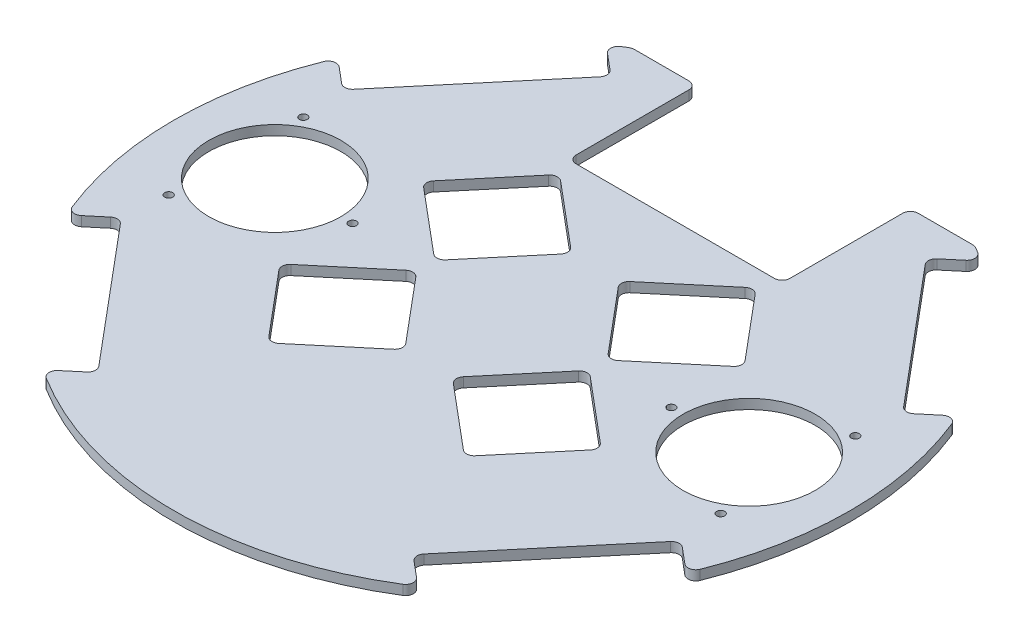
from build123d import *

# Parameters (mm, degrees)
ESBO_O1_R                = 87
RESSALTO_EXTRUS_O1_DEPTH = 2.5
CORTE_EXTRUS_O1_DEPTH    = 2.5
CORTE_EXTRUS_O2_START    = -2.5
ESBO_O3_W                = 27.5
ESBO_O3_H                = 33
CORTE_EXTRUS_O2_DEPTH    = 2.5
FILETE2_R                = 2
ESBO_O4_R                = 17
CORTE_EXTRUS_O3_DEPTH    = 4
CORTE_EXTRUS_O5_DEPTH    = 3
FURO_ROSCADO_DE_M2_51_D  = 2.05


with BuildPart() as part:
    # Esboço1 → Ressalto-extrusão1 (new body)
    with BuildSketch(Plane(origin=(0, 0, 0), x_dir=(1, 0, 0), z_dir=(0, 1, 0))):
        with Locations(Location((0, 0, 0), (0, 0, 270))):
            Circle(ESBO_O1_R)
    extrude(amount=RESSALTO_EXTRUS_O1_DEPTH)

    # Esboço2 → Corte-extrusão1 (cut)
    with BuildSketch(Plane(origin=(0, 2.5, 0), x_dir=(1, 0, 0), z_dir=(0, 1, 0))):
        Polygon((66.645866551, 55.922522043), (82.394162989, 37.154433186), (79.696950599, 34.891203265), (72.036506168, 28.463327168), (40.539913293, 65.999504881), (48.200357724, 72.427380978), (50.897570114, 74.690610899), align=None)
        Polygon((50.897570114, -74.690610899), (82.394162989, -37.154433186), (79.696950599, -34.891203265), (72.036506168, -28.463327168), (40.539913293, -65.999504881), (48.200357724, -72.427380978), align=None)
        Polygon((-72.036506168, 28.463327168), (-40.539913293, 65.999504881), (-48.200357724, 72.427380978), (-50.897570114, 74.690610899), (-66.645866551, 55.922522043), (-82.394162989, 37.154433186), (-79.696950599, 34.891203265), align=None)
        Polygon((-79.696950599, -34.891203265), (-82.394162989, -37.154433186), (-50.897570114, -74.690610899), (-48.200357724, -72.427380978), (-40.539913293, -65.999504881), (-72.036506168, -28.463327168), align=None)
    extrude(amount=-CORTE_EXTRUS_O1_DEPTH, mode=Mode.SUBTRACT)

    # Esboço3 → Corte-extrusão2 (cut)
    with BuildSketch(Plane(origin=(0, 2.5, 0), x_dir=(1, 0, 0), z_dir=(0, 1, 0)).offset(CORTE_EXTRUS_O2_START)):
        with Locations((-13.75, 58.5)):
            Rectangle(ESBO_O3_W, ESBO_O3_H)
        with Locations((13.75, 58.5)):
            Rectangle(ESBO_O3_W, ESBO_O3_H)
        with BuildLine():
            Line((0, 87), (0, 75))
            Line((0, 75), (27.5, 75))
            Line((27.5, 75), (44.09081537, 75))
            ThreePointArc((44.09081537, 75), (22.847319318, 83.946411478), (0, 87))
        make_face()
        with BuildLine():
            Line((-27.5, 75), (0, 75))
            Line((0, 75), (0, 87))
            ThreePointArc((0, 87), (-22.847319318, 83.946411478), (-44.09081537, 75))
            Line((-44.09081537, 75), (-27.5, 75))
        make_face()
    extrude(amount=CORTE_EXTRUS_O2_DEPTH, mode=Mode.SUBTRACT)

    # Filete2
    filete2_edges = [part.edges().sort_by_distance(p)[0] for p in [
        (27.5, 1.25, -42),
        (-27.5, 1.25, -42),
        (-27.5, 1.25, -75),
        (-44.09081537, 1.25, -75),
        (44.09081537, 1.25, -75),
        (27.5, 1.25, -75),
        (79.696950599, 1.25, 34.891203265),
        (72.036506168, 1.25, 28.463327168),
        (48.200357724, 1.25, 72.427380978),
        (40.539913293, 1.25, 65.999504881),
        (-79.696950599, 1.25, -34.891203265),
        (-72.036506168, 1.25, -28.463327168),
        (-48.200357724, 1.25, -72.427380978),
        (-40.539913293, 1.25, -65.999504881),
        (-79.696950599, 1.25, 34.891203265),
        (-48.200357724, 1.25, 72.427380978),
        (-40.539913293, 1.25, 65.999504881),
        (-72.036506168, 1.25, 28.463327168),
        (79.696950599, 1.25, -34.891203265),
        (48.200357724, 1.25, -72.427380978),
        (40.539913293, 1.25, -65.999504881),
        (72.036506168, 1.25, -28.463327168),
    ]]
    fillet(filete2_edges, radius=FILETE2_R)

    # Esboço4 → Corte-extrusão3 (cut)
    with BuildSketch(Plane(origin=(0, 2.5, 0), x_dir=(1, 0, 0), z_dir=(0, 1, 0))):
        with Locations(Location((61, 0, 0), (0, 0, 270))):
            Circle(ESBO_O4_R)
        with Locations(Location((-61, 0, 0), (0, 0, 270))):
            Circle(ESBO_O4_R)
    extrude(amount=-CORTE_EXTRUS_O3_DEPTH, mode=Mode.SUBTRACT)

    # Esboço7 → Corte-extrusão5 (cut)
    with BuildSketch(Plane(origin=(0, 2.5, 0), x_dir=(1, 0, 0), z_dir=(0, 1, 0))):
        with BuildLine():
            Line((-40.056146338, -19.904321081), (-26.557606535, -35.991254386))
            ThreePointArc((-26.557606535, -35.991254386), (-25.199829134, -36.698068563), (-23.739942429, -36.237768053))
            Line((-23.739942429, -36.237768053), (-7.653009124, -22.73922825))
            ThreePointArc((-7.653009124, -22.73922825), (-6.946194947, -21.381450849), (-7.406495457, -19.921564144))
            Line((-7.406495457, -19.921564144), (-20.90503526, -3.834630839))
            ThreePointArc((-20.90503526, -3.834630839), (-22.262812661, -3.127816662), (-23.722699366, -3.588117172))
            Line((-23.722699366, -3.588117172), (-39.809632672, -17.086656975))
            ThreePointArc((-39.809632672, -17.086656975), (-40.516446848, -18.444434376), (-40.056146338, -19.904321081))
        make_face()
        with BuildLine():
            Line((-23.722699366, 3.588117172), (-39.809632672, 17.086656975))
            ThreePointArc((-39.809632672, 17.086656975), (-40.516446848, 18.444434376), (-40.056146338, 19.904321081))
            Line((-40.056146338, 19.904321081), (-26.557606535, 35.991254386))
            ThreePointArc((-26.557606535, 35.991254386), (-25.199829134, 36.698068563), (-23.739942429, 36.237768053))
            Line((-23.739942429, 36.237768053), (-7.653009124, 22.73922825))
            ThreePointArc((-7.653009124, 22.73922825), (-6.946194947, 21.381450849), (-7.406495457, 19.921564144))
            Line((-7.406495457, 19.921564144), (-20.90503526, 3.834630839))
            ThreePointArc((-20.90503526, 3.834630839), (-22.262812661, 3.127816662), (-23.722699366, 3.588117172))
        make_face()
        with BuildLine():
            Line((40.056146338, 19.904321081), (26.557606535, 35.991254386))
            ThreePointArc((26.557606535, 35.991254386), (25.199829134, 36.698068563), (23.739942429, 36.237768053))
            Line((23.739942429, 36.237768053), (7.653009124, 22.73922825))
            ThreePointArc((7.653009124, 22.73922825), (6.946194947, 21.381450849), (7.406495457, 19.921564144))
            Line((7.406495457, 19.921564144), (20.90503526, 3.834630839))
            ThreePointArc((20.90503526, 3.834630839), (22.262812661, 3.127816662), (23.722699366, 3.588117172))
            Line((23.722699366, 3.588117172), (39.809632672, 17.086656975))
            ThreePointArc((39.809632672, 17.086656975), (40.516446848, 18.444434376), (40.056146338, 19.904321081))
        make_face()
        with BuildLine():
            Line((23.722699366, -3.588117172), (39.809632672, -17.086656975))
            ThreePointArc((39.809632672, -17.086656975), (40.516446848, -18.444434376), (40.056146338, -19.904321081))
            Line((40.056146338, -19.904321081), (26.557606535, -35.991254386))
            ThreePointArc((26.557606535, -35.991254386), (25.199829134, -36.698068563), (23.739942429, -36.237768053))
            Line((23.739942429, -36.237768053), (7.653009124, -22.73922825))
            ThreePointArc((7.653009124, -22.73922825), (6.946194947, -21.381450849), (7.406495457, -19.921564144))
            Line((7.406495457, -19.921564144), (20.90503526, -3.834630839))
            ThreePointArc((20.90503526, -3.834630839), (22.262812661, -3.127816662), (23.722699366, -3.588117172))
        make_face()
    extrude(amount=-CORTE_EXTRUS_O5_DEPTH, mode=Mode.SUBTRACT)

    # Furo roscado de M2.51 (through all)
    with Locations(Plane(origin=(-71, 2.5, -17.320508076), x_dir=(0, 0, 1), z_dir=(0, 1, 0))):
        with Locations((0, 0), (17.320508076, 30), (34.641016152, 0), (17.320508076, 112), (0, 142), (34.641016152, 142)):
            Hole(FURO_ROSCADO_DE_M2_51_D / 2)


solid = part.part
